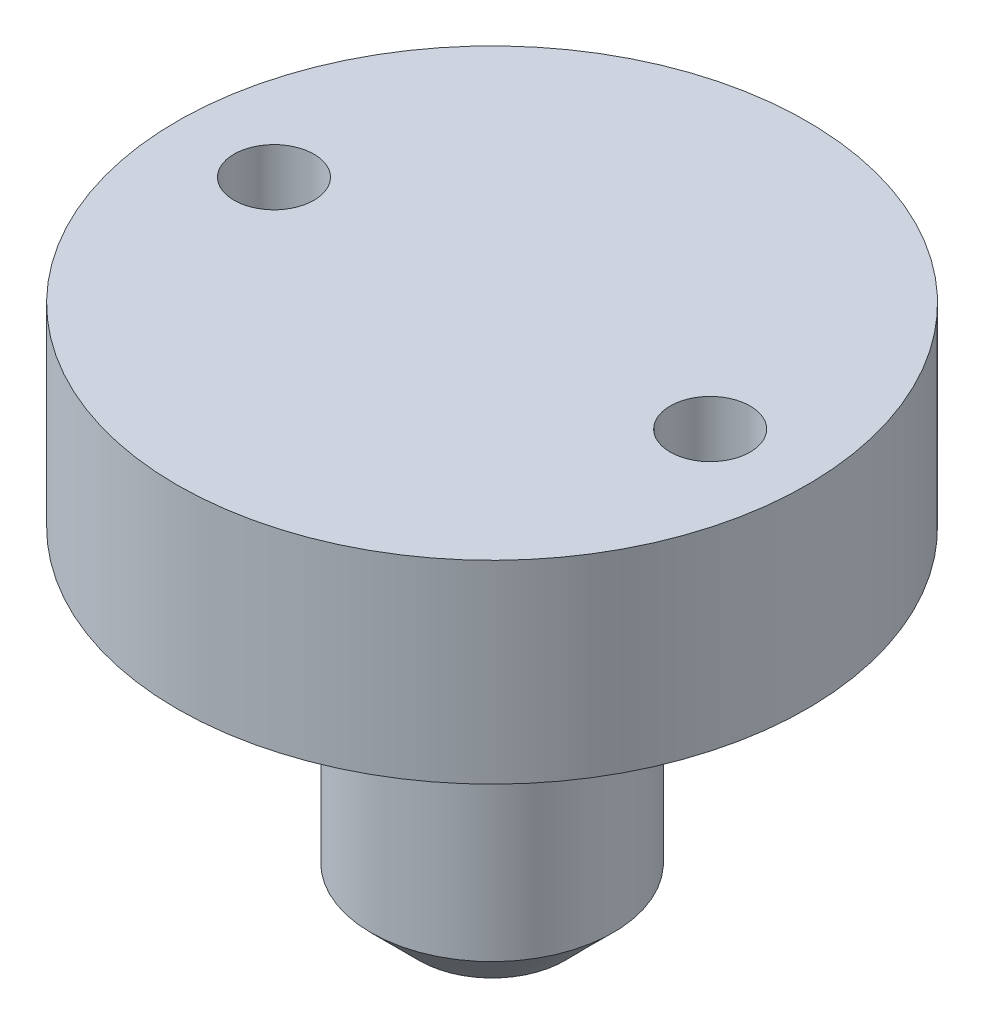
from build123d import *

# Parameters (mm, degrees)
CHAMFER_1_SIZE         = 2
HOLE_WIZARD_M4_1_D     = 3.3
HOLE_WIZARD_M4_1_DEPTH = 4
HOLE_WIZARD_M4_1_TIP   = 0.991420021


with BuildPart() as part:
    # 草图1 → 旋转1 (revolve)
    with BuildSketch(Plane.XY, mode=Mode.PRIVATE) as revolve_1_sk:
        Polygon((0, 0), (5, 0), (5, 12), (4, 12), (4, 14), (13, 14), (13, 22), (0, 22), align=None)
    revolve(revolve_1_sk.sketch.rotate(Axis((0, 60.790955631, 0), (0, -1, 0)), 90), axis=Axis((0, 60.790955631, 0), (0, -1, 0)))

    # 倒角1
    chamfer_1_edges = [part.edges().sort_by_distance(p)[0] for p in [
        (0, 0, -5),
    ]]
    chamfer(chamfer_1_edges, length=CHAMFER_1_SIZE)

    # M4 螺纹孔的螺纹孔钻头1
    with Locations(Plane(origin=(0, 22, 0), x_dir=(-1, 0, 0), z_dir=(0, 1, 0))):
        with Locations((9, 0), (-9, 0)):
            Hole(HOLE_WIZARD_M4_1_D / 2, depth=HOLE_WIZARD_M4_1_DEPTH)
            with Locations((0, 0, -(HOLE_WIZARD_M4_1_DEPTH + HOLE_WIZARD_M4_1_TIP / 2))):  # 118° drill point
                Cone(0, HOLE_WIZARD_M4_1_D / 2, HOLE_WIZARD_M4_1_TIP, mode=Mode.SUBTRACT)


solid = part.part
